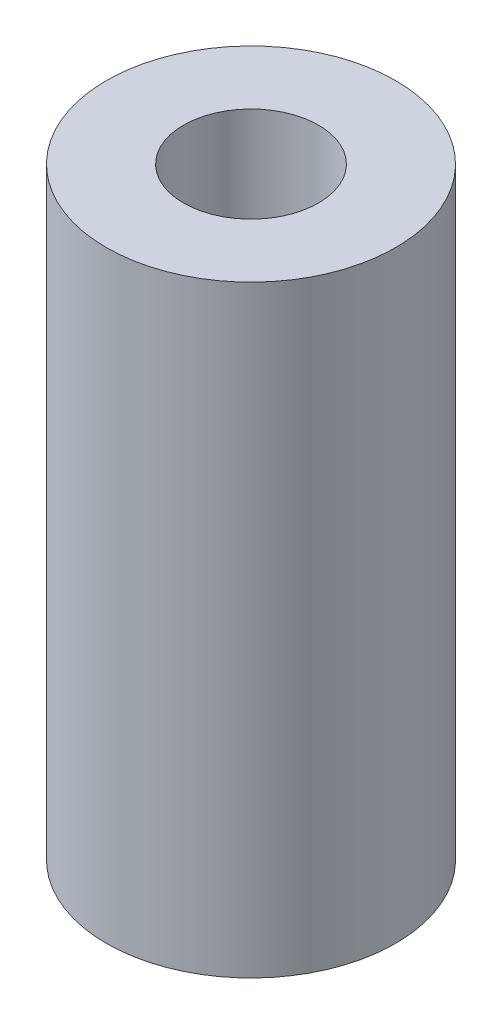
from build123d import *

# Parameters (mm, degrees)
SKETCH1_R           = 3
BOSS_EXTRUDE1_DEPTH = 12.5
SKETCH2_R           = 1.4
CUT_EXTRUDE1_DEPTH  = 10


with BuildPart() as part:
    # Sketch1 → Boss-Extrude1 (new body)
    with BuildSketch(Plane(origin=(0, 0, 0), x_dir=(1, 0, 0), z_dir=(0, 1, 0))):
        with Locations(Location((15.925198458, 13.352169912, 0), (0, 0, 270))):
            Circle(SKETCH1_R)
    extrude(amount=BOSS_EXTRUDE1_DEPTH)

    # Sketch2 → Cut-Extrude1 (cut)
    with BuildSketch(Plane(origin=(0, 12.5, 0), x_dir=(1, 0, 0), z_dir=(0, 1, 0))):
        with Locations(Location((15.925198458, 13.352169912, 0), (0, 0, 270))):
            Circle(SKETCH2_R)
    extrude(amount=-CUT_EXTRUDE1_DEPTH, mode=Mode.SUBTRACT)


solid = part.part
